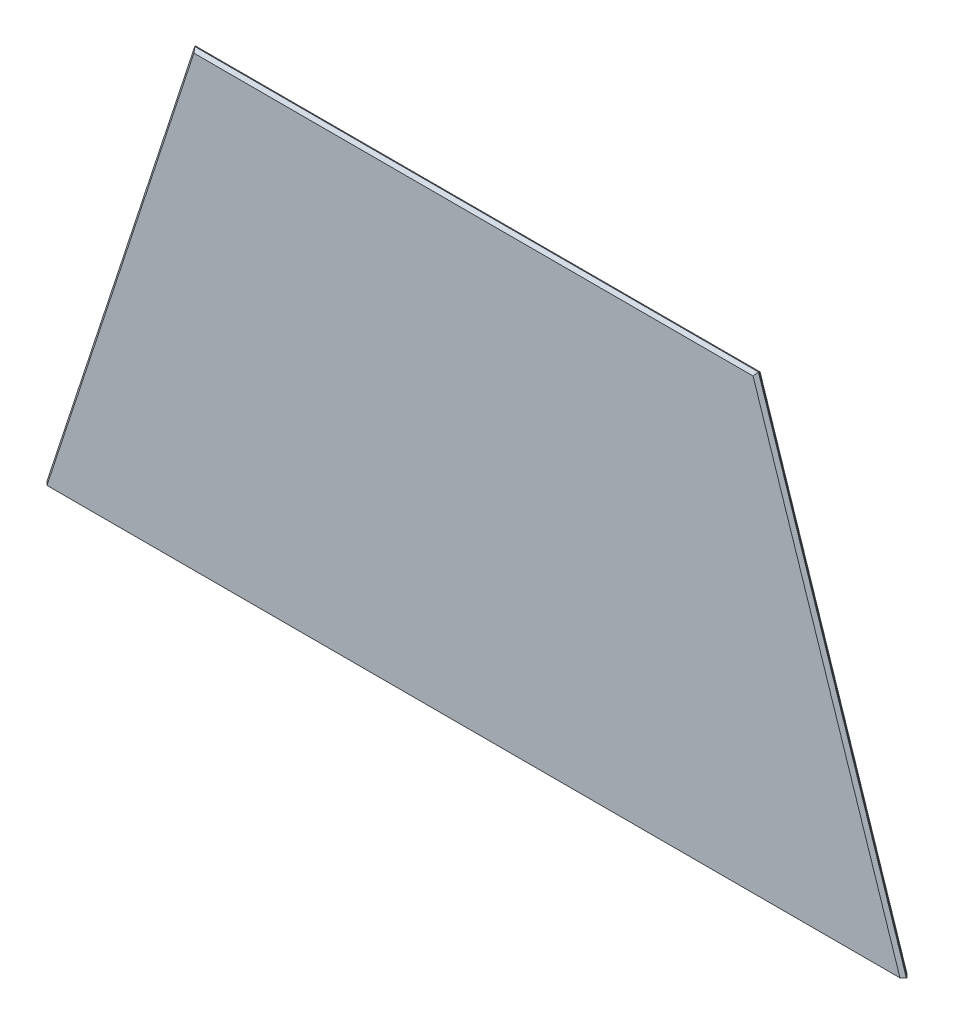
from build123d import *

# Parameters (mm, degrees)
EXTRUDE1_DEPTH = 1.5875
CHAMFER1_SIZE  = 1.397


with BuildPart() as part:
    # Sketch1 → Extrude1 (new, symmetric)
    with BuildSketch(Plane.XY):
        Polygon((0, 0), (193.675, 0), (127, 203.2), (0, 203.2), (-127, 203.2), (-193.675, 0), align=None)
    extrude(amount=EXTRUDE1_DEPTH, both=True)

    # Chamfer1
    chamfer1_edges = [part.edges().sort_by_distance(p)[0] for p in [
        (160.3375, 101.6, 1.5875),
        (0, 203.2, 1.5875),
        (-160.3375, 101.6, 1.5875),
        (-160.3375, 101.6, -1.5875),
        (0, 203.2, -1.5875),
        (160.3375, 101.6, -1.5875),
    ]]
    chamfer(chamfer1_edges, length=CHAMFER1_SIZE)


solid = part.part
